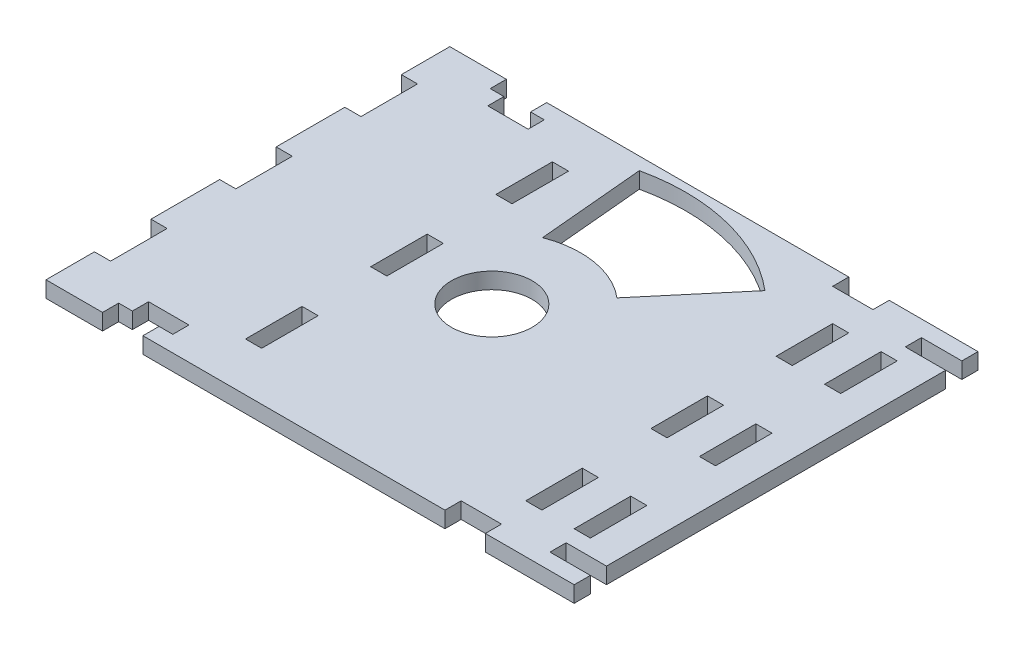
from build123d import *

# Parameters (mm, degrees)
SKETCH2_W           = 100
SKETCH2_H           = 50
SKETCH2_R           = 5
BOSS_EXTRUDE1_DEPTH = 2
SKETCH5_W           = 2
SKETCH5_H           = 7
CUT_EXTRUDE3_DEPTH  = 2
CUT_EXTRUDE6_DEPTH  = 2
SKETCH11_W          = 5
SKETCH11_H          = 2
CUT_EXTRUDE7_DEPTH  = 2
SKETCH12_W          = 6.5
SKETCH12_H          = 50
SKETCH12_W_2        = 2.8
CUT_EXTRUDE8_DEPTH  = 6
SKETCH13_W          = 12
SKETCH13_H          = 50
SKETCH13_W_2        = 2
SKETCH13_H_2        = 7
SKETCH13_W_3        = 5
SKETCH13_H_3        = 2
CUT_EXTRUDE10_DEPTH = 6


with BuildPart() as part:
    # Sketch2 → Boss-Extrude1 (new body)
    with BuildSketch(Plane(origin=(0, 0, 0), x_dir=(1, 0, 0), z_dir=(0, 1, 0))):
        Rectangle(SKETCH2_W, SKETCH2_H)
        with Locations(Location((0, 0, 0), (0, 0, 270))):
            Circle(SKETCH2_R, mode=Mode.SUBTRACT)
    extrude(amount=BOSS_EXTRUDE1_DEPTH)

    # Sketch5 → Cut-Extrude3 (cut)
    with BuildSketch(Plane(origin=(0, 0, 0), x_dir=(-1, 0, 0), z_dir=(0, -1, 0))):
        with Locations((-24.2, -15.5)):
            Rectangle(SKETCH5_W, SKETCH5_H)
        with Locations((-24.2, 0)):
            Rectangle(SKETCH5_W, SKETCH5_H)
        with Locations((-24.2, 15.5)):
            Rectangle(SKETCH5_W, SKETCH5_H)
        with Locations((10.5, 15.5)):
            Rectangle(SKETCH5_W, SKETCH5_H)
        with Locations((10.5, 0)):
            Rectangle(SKETCH5_W, SKETCH5_H)
        with Locations((10.5, -15.5)):
            Rectangle(SKETCH5_W, SKETCH5_H)
    extrude(amount=-CUT_EXTRUDE3_DEPTH, mode=Mode.SUBTRACT)

    # Sketch10 → Cut-Extrude6 (cut)
    with BuildSketch(Plane(origin=(0, 2, 0), x_dir=(1, 0, 0), z_dir=(0, 1, 0))):
        with BuildLine():
            ThreePointArc((-5.171573663, 23.436186248), (5.745726742, 23.302073389), (15.473926709, 18.345506049))
            Line((15.473926709, 18.345506049), (7.092216408, 8.408356939))
            ThreePointArc((7.092216408, 8.408356939), (1.811815129, 10.849761561), (-3.975341771, 10.256542195))
            Line((-3.975341771, 10.256542195), (-5.171573663, 23.436186248))
        make_face()
    extrude(amount=-CUT_EXTRUDE6_DEPTH, mode=Mode.SUBTRACT)

    # Sketch11 → Cut-Extrude7 (cut)
    with BuildSketch(Plane(origin=(0, 2, 0), x_dir=(1, 0, 0), z_dir=(0, 1, 0))):
        with Locations((32.7, 22)):
            Rectangle(SKETCH11_W, SKETCH11_H)
        with Locations((-19, 22)):
            Rectangle(SKETCH11_W, SKETCH11_H)
        with Locations((-19, -22)):
            Rectangle(SKETCH11_W, SKETCH11_H)
        with Locations((32.7, -22)):
            Rectangle(SKETCH11_W, SKETCH11_H)
    extrude(amount=-CUT_EXTRUDE7_DEPTH, mode=Mode.SUBTRACT)

    # Sketch12 → Cut-Extrude8 (cut)
    with BuildSketch(Plane(origin=(0, 2, 0), x_dir=(1, 0, 0), z_dir=(0, 1, 0))):
        with Locations((-46.75, 0)):
            Rectangle(SKETCH12_W, SKETCH12_H)
        with Locations((48.6, 0)):
            Rectangle(SKETCH12_W_2, SKETCH12_H)
    extrude(amount=-CUT_EXTRUDE8_DEPTH, mode=Mode.SUBTRACT)

    # Sketch13 → Cut-Extrude10 (cut)
    with BuildSketch(Plane(origin=(0, 2, 0), x_dir=(1, 0, 0), z_dir=(0, 1, 0))):
        with Locations((41.2, 0)):
            Rectangle(SKETCH13_W, SKETCH13_H)
        with Locations((30.2, 15.5)):
            Rectangle(SKETCH13_W_2, SKETCH13_H_2)
        with Locations((30.2, -15.5)):
            Rectangle(SKETCH13_W_2, SKETCH13_H_2)
        with Locations((30.2, 0)):
            Rectangle(SKETCH13_W_2, SKETCH13_H_2)
        Polygon((-28.2, 12), (-28.2, 19), (-30.2, 19), (-30.2, 25), (-43.5, 25), (-43.5, -25), (-30.2, -25), (-30.2, -19), (-28.2, -19), (-28.2, -12), (-30.2, -12), (-30.2, -3.5), (-28.2, -3.5), (-28.2, 3.5), (-30.2, 3.5), (-30.2, 12), align=None)
        with Locations((21.7, -24)):
            Rectangle(SKETCH13_W_3, SKETCH13_H_3)
        with Locations((21.7, 24)):
            Rectangle(SKETCH13_W_3, SKETCH13_H_3)
        with Locations((-20.7, 24)):
            Rectangle(SKETCH13_W_3, SKETCH13_H_3)
        with Locations((-20.7, -24)):
            Rectangle(SKETCH13_W_3, SKETCH13_H_3)
    extrude(amount=-CUT_EXTRUDE10_DEPTH, mode=Mode.SUBTRACT)


solid = part.part
